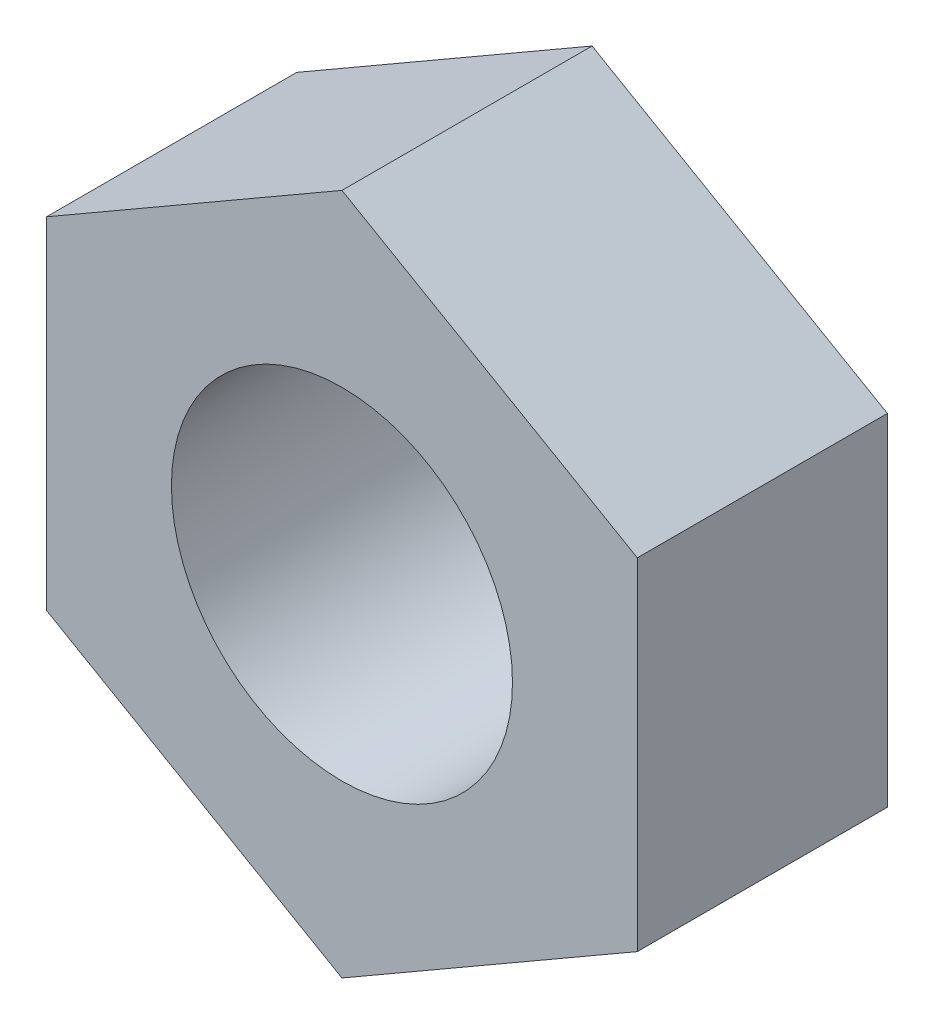
from build123d import *

# Parameters (mm, degrees)
SKETCH1_R           = 1.5
BOSS_EXTRUDE1_DEPTH = 2.2


with BuildPart() as part:
    # Sketch1 → Boss-Extrude1 (new body)
    with BuildSketch(Plane.XY):
        Polygon((0, 3), (-2.598076211, 1.5), (-2.598076211, -1.5), (0, -3), (2.598076211, -1.5), (2.598076211, 1.5), align=None)
        Circle(SKETCH1_R, mode=Mode.SUBTRACT)
    extrude(amount=BOSS_EXTRUDE1_DEPTH)


solid = part.part
